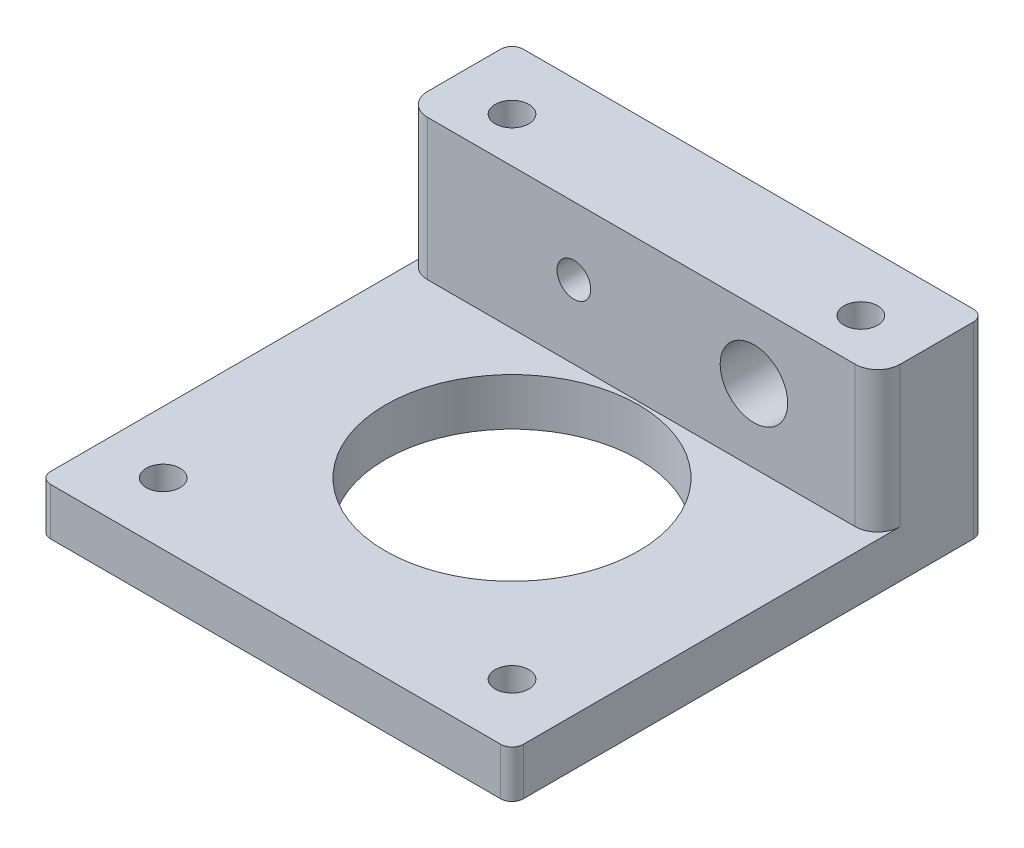
from build123d import *

# Parameters (mm, degrees)
SKETCH_1_W          = 42
SKETCH_1_H          = 42
SKETCH_1_R          = 1.5
EXTRUDE_1_DEPTH     = 4.2
SKETCH_2_W          = 42
SKETCH_2_H          = 9.5
SKETCH_2_R          = 1.5
EXTRUDE_2_DEPTH     = 12.5
SKETCH_3_R          = 11.25
CUT_EXTRUDE_1_DEPTH = 33.221886971
SKETCH_4_R          = 3
SKETCH_4_R_2        = 1.5
CUT_EXTRUDE_2_DEPTH = 50.838639628
SKETCH_5_R          = 3.5
CUT_EXTRUDE_3_DEPTH = 2
FILLET_2_R          = 1
FILLET_3_R          = 2


with BuildPart() as part:
    # 草图1 → 凸台-拉伸1 (new body)
    with BuildSketch(Plane(origin=(0, 0, 0), x_dir=(1, 0, 0), z_dir=(0, 1, 0))):
        Rectangle(SKETCH_1_W, SKETCH_1_H)
        with Locations(Location((-15.5, 15.5, 0), (0, 0, 270))):
            Circle(SKETCH_1_R, mode=Mode.SUBTRACT)
        with Locations(Location((15.5, 15.5, 0), (0, 0, 270))):
            Circle(SKETCH_1_R, mode=Mode.SUBTRACT)
        with Locations(Location((-15.5, -15.5, 0), (0, 0, 270))):
            Circle(SKETCH_1_R, mode=Mode.SUBTRACT)
        with Locations(Location((15.5, -15.5, 0), (0, 0, 270))):
            Circle(SKETCH_1_R, mode=Mode.SUBTRACT)
    extrude(amount=EXTRUDE_1_DEPTH)

    # 草图2 → 凸台-拉伸2 (add)
    with BuildSketch(Plane(origin=(0, 4.2, 0), x_dir=(1, 0, 0), z_dir=(0, 1, 0))):
        with Locations((0, 16.25)):
            Rectangle(SKETCH_2_W, SKETCH_2_H)
        with Locations(Location((-15.5, 15.5, 0), (0, 0, 270))):
            Circle(SKETCH_2_R, mode=Mode.SUBTRACT)
        with Locations(Location((15.5, 15.5, 0), (0, 0, 270))):
            Circle(SKETCH_2_R, mode=Mode.SUBTRACT)
    extrude(amount=EXTRUDE_2_DEPTH)

    # 草图3 → 切除-拉伸1 (cut, through all)
    with BuildSketch(Plane(origin=(0, 4.2, 0), x_dir=(1, 0, 0), z_dir=(0, 1, 0))):
        with Locations(Location((0, 0, 0), (0, 0, 270))):
            Circle(SKETCH_3_R)
    extrude(amount=-CUT_EXTRUDE_1_DEPTH, mode=Mode.SUBTRACT)

    # 草图4 → 切除-拉伸2 (cut, through all)
    with BuildSketch(Plane(origin=(0, 0, -21), x_dir=(-1, 0, 0), z_dir=(0, 0, -1))):
        with Locations((-10, 10.7)):
            Circle(SKETCH_4_R)
        with Locations((6, 10.7)):
            Circle(SKETCH_4_R_2)
    extrude(amount=-CUT_EXTRUDE_2_DEPTH, mode=Mode.SUBTRACT)

    # 草图5 → 切除-拉伸3 (cut)
    with BuildSketch(Plane(origin=(0, 0, -21), x_dir=(-1, 0, 0), z_dir=(0, 0, -1))):
        with Locations((6, 10.7)):
            Circle(SKETCH_5_R)
    extrude(amount=-CUT_EXTRUDE_3_DEPTH, mode=Mode.SUBTRACT)

    # 圆角2
    fillet_2_edges = [part.edges().sort_by_distance(p)[0] for p in [
        (21, 2.1, 21),
        (-21, 2.1, 21),
        (-21, 8.35, -21),
        (21, 8.35, -21),
    ]]
    fillet(fillet_2_edges, radius=FILLET_2_R)

    # 圆角3
    fillet_3_edges = [part.edges().sort_by_distance(p)[0] for p in [
        (-21, 10.45, -11.5),
        (21, 10.45, -11.5),
    ]]
    fillet(fillet_3_edges, radius=FILLET_3_R)


solid = part.part
